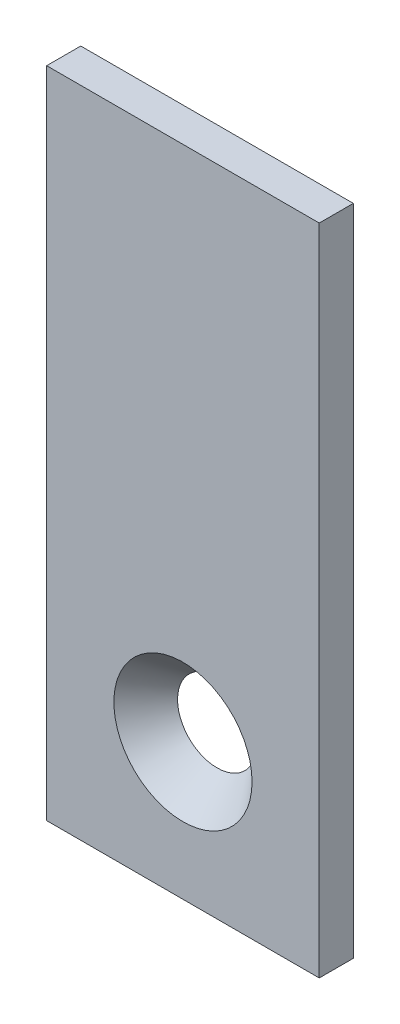
from build123d import *

# Parameters (mm, degrees)
SKETCH1_W           = 25.4
SKETCH1_H           = 60.9287072
BOSS_EXTRUDE1_DEPTH = 1.5875


with BuildPart() as part:
    # Sketch1 → Boss-Extrude1 (new, symmetric)
    with BuildSketch(Plane.XY):
        Rectangle(SKETCH1_W, SKETCH1_H)
    extrude(amount=BOSS_EXTRUDE1_DEPTH, both=True)

    # Sketch3 → CSK for 1/4 Flat Head Machine Screw1 (revolve, cut)
    with BuildSketch(Plane(origin=(0, -17.7643536, 1.5875), x_dir=(0, -1, 0), z_dir=(1, 0, 0))):
        Polygon((0, 0), (0, 3.175), (3.3782, 3.175), (3.3782, 3.520932584), (6.4389, 0), align=None)
    revolve(axis=Axis((0, -17.7643536, 7.9375), (0, 0, -1)), mode=Mode.SUBTRACT)


solid = part.part
